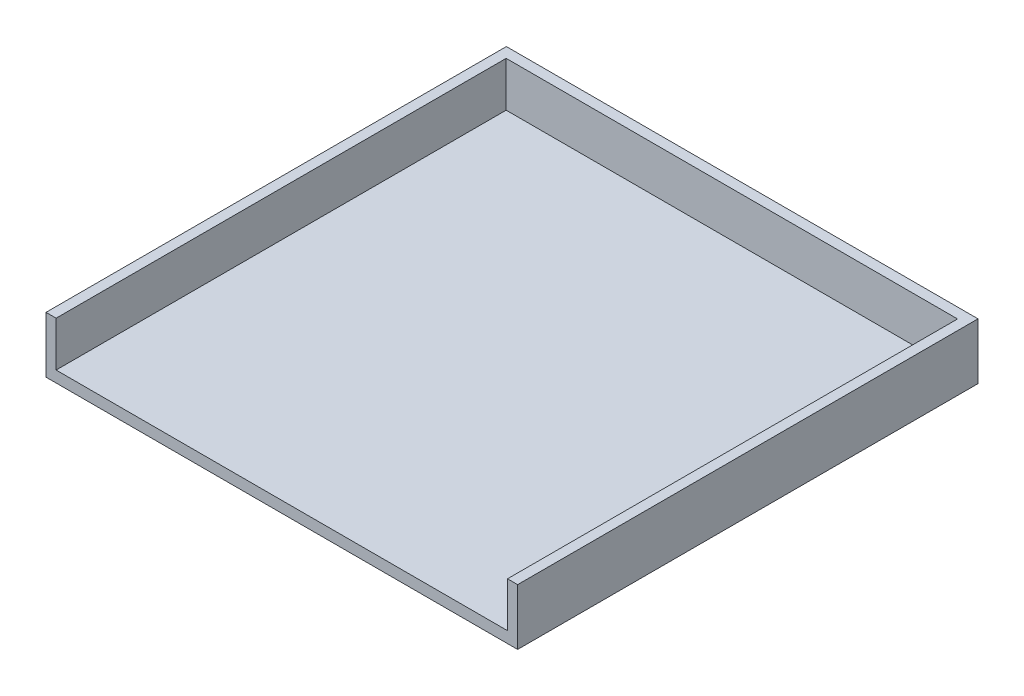
from build123d import *

# Parameters (mm, degrees)
SKETCH_1_W      = 105
SKETCH_1_H      = 102.5
EXTRUDE_1_DEPTH = 2.5
EXTRUDE_2_DEPTH = 10


with BuildPart() as part:
    # Эскиз1 → Бобышка-Вытянуть1 (new body)
    with BuildSketch(Plane(origin=(0, 0, 0), x_dir=(1, 0, 0), z_dir=(0, 1, 0))):
        with Locations((57.513799089, -63.375984423)):
            Rectangle(SKETCH_1_W, SKETCH_1_H)
    extrude(amount=EXTRUDE_1_DEPTH)

    # Эскиз2 → Бобышка-Вытянуть2 (add)
    with BuildSketch(Plane(origin=(0, 2.5, 0), x_dir=(1, 0, 0), z_dir=(0, 1, 0))):
        Polygon((5.013799089, -12.125984423), (110.013799089, -12.125984423), (110.013799089, -114.625984423), (107.763799089, -114.625984423), (107.763799089, -112.909428801), (107.763799089, -14.425984423), (7.263799089, -14.425984423), (7.263799089, -112.909428801), (7.263799089, -114.625984423), (5.013799089, -114.625984423), align=None)
    extrude(amount=EXTRUDE_2_DEPTH)


solid = part.part
